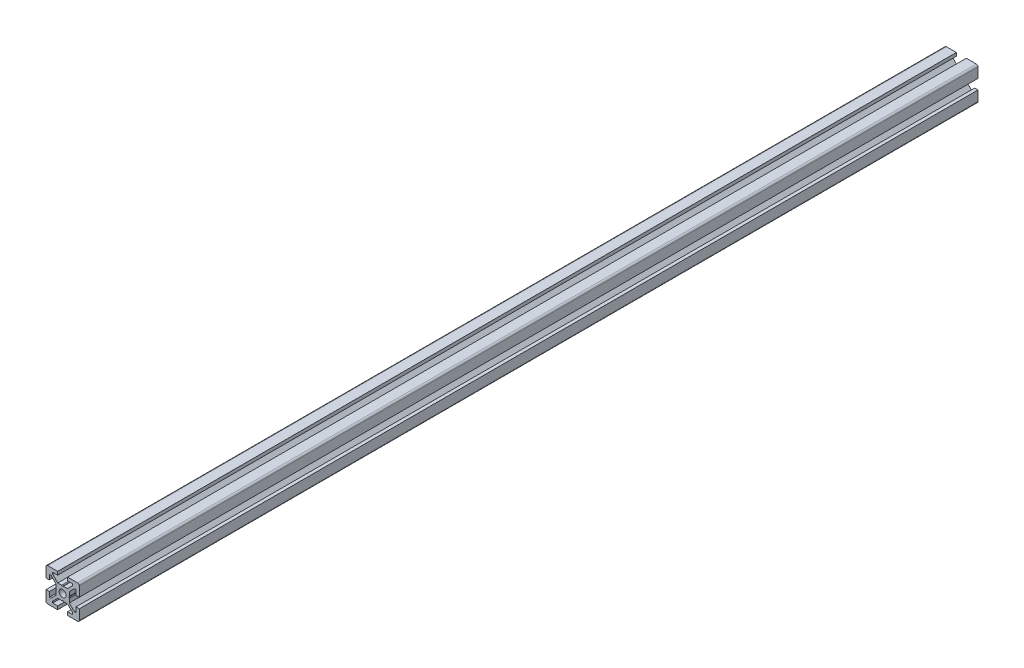
from build123d import *

# Parameters (mm, degrees)
SKETCH1_R           = 2.1
BOSS_EXTRUDE1_DEPTH = 540


with BuildPart() as part:
    # Sketch1 → Boss-Extrude1 (new body)
    with BuildSketch(Plane(origin=(0, 0, -500), x_dir=(-1, 0, 0), z_dir=(0, 0, -1))):
        with BuildLine():
            Line((9, 10), (3, 10))
            Line((3, 10), (3, 8))
            Line((3, 8), (6, 8))
            Line((6, 8), (6, 7.060660172))
            Line((6, 7.060660172), (2.939339828, 4))
            Line((2.939339828, 4), (0.519615242, 4))
            Line((0.519615242, 4), (0, 3.7))
            Line((0, 3.7), (-0.519615242, 4))
            Line((-0.519615242, 4), (-2.939339828, 4))
            Line((-2.939339828, 4), (-6, 7.060660172))
            Line((-6, 7.060660172), (-6, 8))
            Line((-6, 8), (-3, 8))
            Line((-3, 8), (-3, 10))
            Line((-3, 10), (-9, 10))
            ThreePointArc((-9, 10), (-9.707106781, 9.707106781), (-10, 9))
            Line((-10, 9), (-10, 3))
            Line((-10, 3), (-8, 3))
            Line((-8, 3), (-8, 6))
            Line((-8, 6), (-7.060660172, 6))
            Line((-7.060660172, 6), (-4, 2.939339828))
            Line((-4, 2.939339828), (-4, 0.519615242))
            Line((-4, 0.519615242), (-3.7, 0))
            Line((-3.7, 0), (-4, -0.519615242))
            Line((-4, -0.519615242), (-4, -2.939339828))
            Line((-4, -2.939339828), (-7.060660172, -6))
            Line((-7.060660172, -6), (-8, -6))
            Line((-8, -6), (-8, -3))
            Line((-8, -3), (-10, -3))
            Line((-10, -3), (-10, -9))
            ThreePointArc((-10, -9), (-9.707106781, -9.707106781), (-9, -10))
            Line((-9, -10), (-3, -10))
            Line((-3, -10), (-3, -8))
            Line((-3, -8), (-6, -8))
            Line((-6, -8), (-6, -7.060660172))
            Line((-6, -7.060660172), (-2.939339828, -4))
            Line((-2.939339828, -4), (-0.519615242, -4))
            Line((-0.519615242, -4), (0, -3.7))
            Line((0, -3.7), (0.519615242, -4))
            Line((0.519615242, -4), (2.939339828, -4))
            Line((2.939339828, -4), (6, -7.060660172))
            Line((6, -7.060660172), (6, -8))
            Line((6, -8), (3, -8))
            Line((3, -8), (3, -10))
            Line((3, -10), (9, -10))
            ThreePointArc((9, -10), (9.707106781, -9.707106781), (10, -9))
            Line((10, -9), (10, -3))
            Line((10, -3), (8, -3))
            Line((8, -3), (8, -6))
            Line((8, -6), (7.060660172, -6))
            Line((7.060660172, -6), (4, -2.939339828))
            Line((4, -2.939339828), (4, -0.519615242))
            Line((4, -0.519615242), (3.7, 0))
            Line((3.7, 0), (4, 0.519615242))
            Line((4, 0.519615242), (4, 2.939339828))
            Line((4, 2.939339828), (7.060660172, 6))
            Line((7.060660172, 6), (8, 6))
            Line((8, 6), (8, 3))
            Line((8, 3), (10, 3))
            Line((10, 3), (10, 9))
            ThreePointArc((10, 9), (9.707106781, 9.707106781), (9, 10))
        make_face()
        with Locations(Location((0, 0, 0), (0, 0, 180))):
            Circle(SKETCH1_R, mode=Mode.SUBTRACT)
    extrude(amount=-BOSS_EXTRUDE1_DEPTH)


solid = part.part
